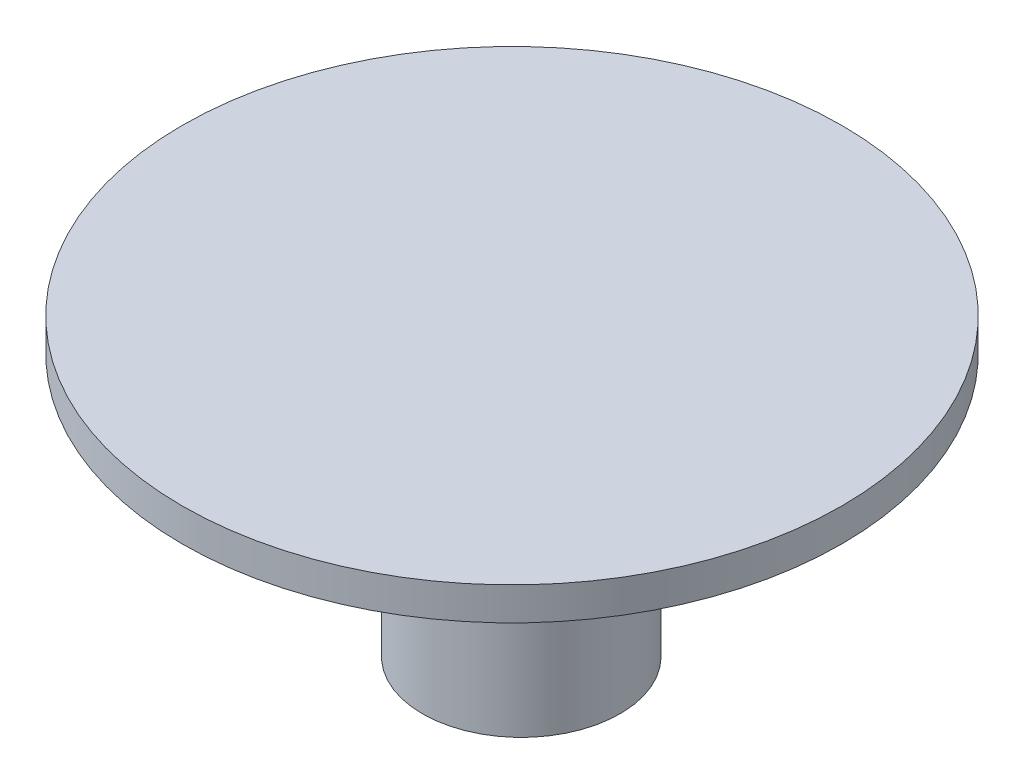
from build123d import *

# Parameters (mm, degrees)
SKETCH1_R           = 3
BOSS_EXTRUDE1_DEPTH = 8
SKETCH2_R           = 10.006365311
BOSS_EXTRUDE2_DEPTH = 1


with BuildPart() as part:
    # Sketch1 → Boss-Extrude1 (new body)
    with BuildSketch(Plane(origin=(0, 0, 0), x_dir=(1, 0, 0), z_dir=(0, 1, 0))):
        with Locations(Location((-4.416626144, 7.143510097, 0), (0, 0, 270))):
            Circle(SKETCH1_R)
    extrude(amount=BOSS_EXTRUDE1_DEPTH)

    # Sketch2 → Boss-Extrude2 (add)
    with BuildSketch(Plane(origin=(0, 8, 0), x_dir=(1, 0, 0), z_dir=(0, 1, 0))):
        with Locations(Location((-4.521911095, 6.9677292, 0), (0, 0, 270))):
            Circle(SKETCH2_R)
    extrude(amount=BOSS_EXTRUDE2_DEPTH)


solid = part.part
